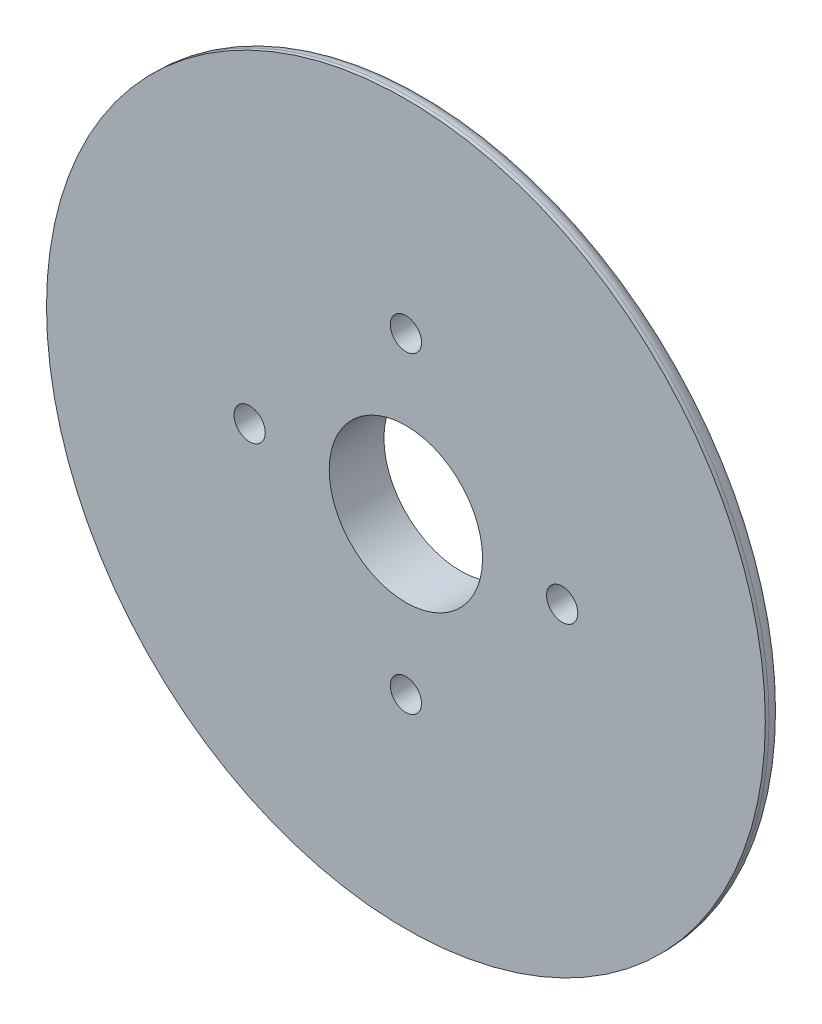
from build123d import *

# Parameters (mm, degrees)
BOSS_EXTRUDE1_DEPTH          = 4
SKETCH3_R                    = 1.5
BOSS_EXTRUDE2_DEPTH          = 6
F_3_0_3_DIAMETER_HOLE1_D     = 3
F_3_0_3_DIAMETER_HOLE1_DEPTH = 10
F_4_0_4_DIAMETER_HOLE1_D     = 4
F_4_0_4_DIAMETER_HOLE1_DEPTH = 10
FILLET1_R                    = 2
FILLET2_R                    = 14.5
CUT_EXTRUDE1_DEPTH           = 73.945185819
CUT_EXTRUDE1_DEPTH_BACK      = 22
SKETCH8_R                    = 46
SKETCH9_R                    = 9.814954576
CUT_EXTRUDE2_DEPTH           = 21


with BuildPart() as part:
    # Sketch1 → Revolve1 (revolve)
    with BuildSketch(Plane(origin=(0, 0, 0), x_dir=(1, 0, 0), z_dir=(0, 1, 0))):
        Polygon((28, 45.5), (0, 45.5), (0, 16.5), (36, 16.5), (46, 26.5), (46, 40.5), align=None)
    revolve(axis=Axis((0, 0, -45.5), (0, 0, 1)))

    # Sketch2 → Boss-Extrude1 (add)
    with BuildSketch(Plane(origin=(0, 0, -45.5), x_dir=(-1, 0, 0), z_dir=(0, 0, -1))):
        Polygon((-9.814954576, 0), (-4.907477288, 8.5), (4.907477288, 8.5), (9.814954576, 0), (4.907477288, -8.5), (-4.907477288, -8.5), align=None)
    extrude(amount=BOSS_EXTRUDE1_DEPTH)

    # Sketch3 → Boss-Extrude2 (add)
    with BuildSketch(Plane.XY.offset(-16.5)):
        Circle(SKETCH3_R)
    extrude(amount=BOSS_EXTRUDE2_DEPTH)

    # Ø3.0 (3) Diameter Hole1
    with Locations(Plane.XY.offset(-16.5)):
        with Locations((-15.5, 0), (0, 15.5), (0, -15.5), (15.5, 0)):
            Hole(F_3_0_3_DIAMETER_HOLE1_D / 2, depth=F_3_0_3_DIAMETER_HOLE1_DEPTH)

    # Ø4.0 (4) Diameter Hole1
    with Locations(Plane(origin=(0, 0, -45.5), x_dir=(-1, 0, 0), z_dir=(0, 0, -1))):
        with Locations((0, -20), (-20, 0), (20, 0), (0, 20)):
            Hole(F_4_0_4_DIAMETER_HOLE1_D / 2, depth=F_4_0_4_DIAMETER_HOLE1_DEPTH)

    # Fillet1
    fillet1_edges = [part.edges().sort_by_distance(p)[0] for p in [
        (-46, 0, -40.5),
        (-46, 0, -26.5),
    ]]
    fillet(fillet1_edges, radius=FILLET1_R)

    # Fillet2
    fillet2_edges = [part.edges().sort_by_distance(p)[0] for p in [
        (-36, 0, -16.5),
    ]]
    fillet(fillet2_edges, radius=FILLET2_R)

    # Sketch8 → Cut-Extrude1 (cut, two sides: drawn at the far end of the back side and taken through both)
    with BuildSketch(Plane.XY.offset(-16.5).offset(-CUT_EXTRUDE1_DEPTH_BACK)):
        Circle(SKETCH8_R)
    extrude(amount=CUT_EXTRUDE1_DEPTH + CUT_EXTRUDE1_DEPTH_BACK, mode=Mode.SUBTRACT)

    # Sketch9 → Cut-Extrude2 (cut)
    with BuildSketch(Plane(origin=(0, 0, -49.5), x_dir=(-1, 0, 0), z_dir=(0, 0, -1))):
        Circle(SKETCH9_R)
    extrude(amount=-CUT_EXTRUDE2_DEPTH, mode=Mode.SUBTRACT)


solid = part.part
